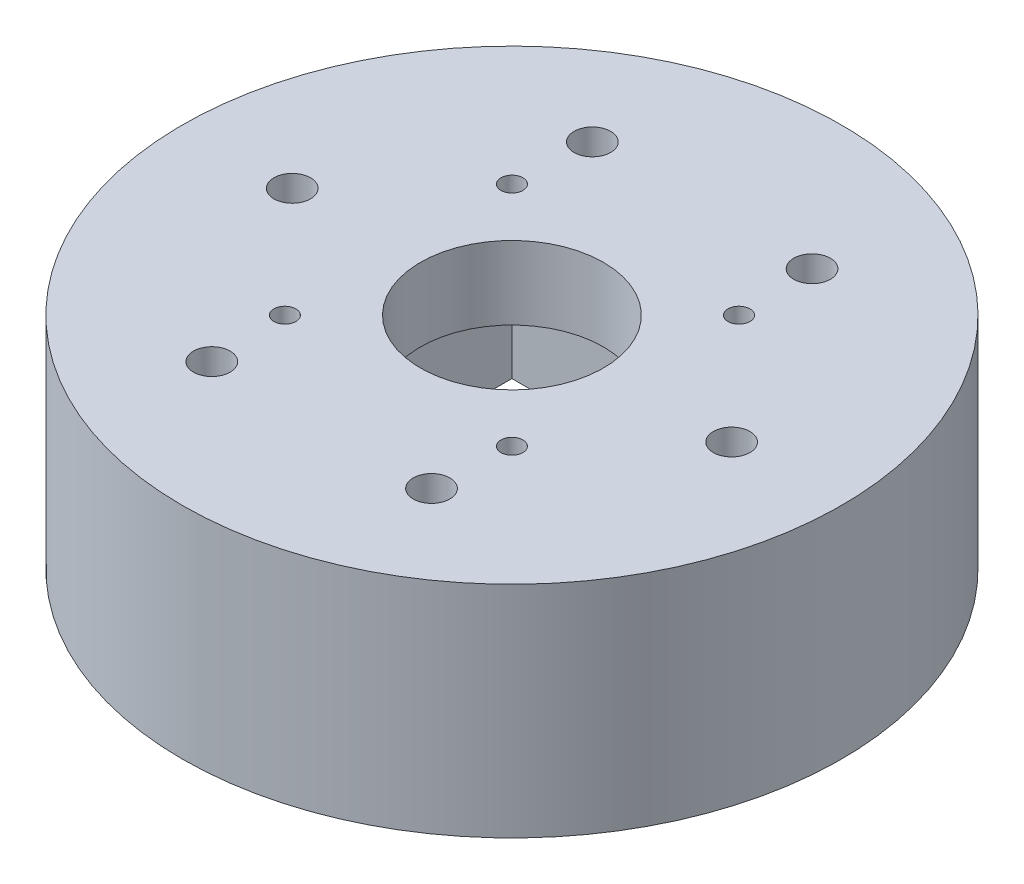
from build123d import *

# Parameters (mm, degrees)
SKETCH1_R           = 45
BOSS_EXTRUDE1_DEPTH = 30
SKETCH2_R           = 4
CUT_EXTRUDE1_DEPTH  = 20
SKETCH4_R           = 2.5
CUT_EXTRUDE2_DEPTH  = 30
SKETCH5_W           = 45
SKETCH5_H           = 45
CUT_EXTRUDE3_DEPTH  = 20
SKETCH6_R           = 12.5
CUT_EXTRUDE4_DEPTH  = 10


with BuildPart() as part:
    # Sketch1 → Boss-Extrude1 (new body)
    with BuildSketch(Plane(origin=(0, 0, 0), x_dir=(1, 0, 0), z_dir=(0, 1, 0))):
        with Locations(Location((0, 0, 0), (0, 0, 270))):
            Circle(SKETCH1_R)
    extrude(amount=BOSS_EXTRUDE1_DEPTH)

    # Sketch2 → Cut-Extrude1 (cut)
    with BuildSketch(Plane.XZ):
        with Locations(Location((0, 32.5, 0), (0, 0, 270))):
            Circle(SKETCH2_R)
        with Locations(Location((0, -32.5, 0), (0, 0, 270))):
            Circle(SKETCH2_R)
    extrude(amount=-CUT_EXTRUDE1_DEPTH, mode=Mode.SUBTRACT)

    # Sketch4 → Cut-Extrude2 (cut)
    with BuildSketch(Plane(origin=(0, 0, 0), x_dir=(-1, 0, 0), z_dir=(0, -1, 0))):
        with Locations(Location((-30, 0, 0), (0, 0, 90))):
            Circle(SKETCH4_R)
        with Locations(Location((-15, 25.980762114, 0), (0, 0, 90))):
            Circle(SKETCH4_R)
        with Locations(Location((15, 25.980762114, 0), (0, 0, 90))):
            Circle(SKETCH4_R)
        with Locations(Location((30, 0, 0), (0, 0, 90))):
            Circle(SKETCH4_R)
        with Locations(Location((15, -25.980762114, 0), (0, 0, 90))):
            Circle(SKETCH4_R)
        with Locations(Location((-15, -25.980762114, 0), (0, 0, 90))):
            Circle(SKETCH4_R)
    extrude(amount=-CUT_EXTRUDE2_DEPTH, mode=Mode.SUBTRACT)

    # Sketch5 → Cut-Extrude3 (cut)
    with BuildSketch(Plane(origin=(0, 0, 0), x_dir=(-1, 0, 0), z_dir=(0, -1, 0))):
        Rectangle(SKETCH5_W, SKETCH5_H)
    extrude(amount=-CUT_EXTRUDE3_DEPTH, mode=Mode.SUBTRACT)

    # Sketch6 → Cut-Extrude4 (cut)
    with BuildSketch(Plane.XZ.offset(-20)):
        with BuildLine():
            Line((-15.5, 14), (-15.5, 15.5))
            Line((-15.5, 15.5), (-14, 15.5))
            ThreePointArc((-14, 15.5), (-16.560660172, 16.560660172), (-15.5, 14))
        make_face()
        with BuildLine():
            Line((-14, 15.5), (-15.5, 15.5))
            Line((-15.5, 15.5), (-15.5, 14))
            ThreePointArc((-15.5, 14), (-14.439339828, 14.439339828), (-14, 15.5))
        make_face()
        with BuildLine():
            ThreePointArc((17, 15.5), (15.5, 17), (14, 15.5))
            Line((14, 15.5), (15.5, 15.5))
            Line((15.5, 15.5), (15.5, 14))
            ThreePointArc((15.5, 14), (16.560660172, 14.439339828), (17, 15.5))
        make_face()
        with BuildLine():
            Line((15.5, 15.5), (14, 15.5))
            ThreePointArc((14, 15.5), (14.439339828, 14.439339828), (15.5, 14))
            Line((15.5, 14), (15.5, 15.5))
        make_face()
        with Locations(Location((0, 0, 0), (0, 0, 270))):
            Circle(SKETCH6_R)
        with BuildLine():
            ThreePointArc((17, -15.5), (16.560660172, -14.439339828), (15.5, -14))
            Line((15.5, -14), (15.5, -15.5))
            Line((15.5, -15.5), (14, -15.5))
            ThreePointArc((14, -15.5), (15.5, -17), (17, -15.5))
        make_face()
        with BuildLine():
            Line((15.5, -15.5), (15.5, -14))
            ThreePointArc((15.5, -14), (14.439339828, -14.439339828), (14, -15.5))
            Line((14, -15.5), (15.5, -15.5))
        make_face()
        with BuildLine():
            ThreePointArc((-14, -15.5), (-14.439339828, -14.439339828), (-15.5, -14))
            Line((-15.5, -14), (-15.5, -15.5))
            Line((-15.5, -15.5), (-14, -15.5))
        make_face()
        with BuildLine():
            Line((-15.5, -15.5), (-15.5, -14))
            ThreePointArc((-15.5, -14), (-16.560660172, -16.560660172), (-14, -15.5))
            Line((-14, -15.5), (-15.5, -15.5))
        make_face()
    extrude(amount=-CUT_EXTRUDE4_DEPTH, mode=Mode.SUBTRACT)


solid = part.part
